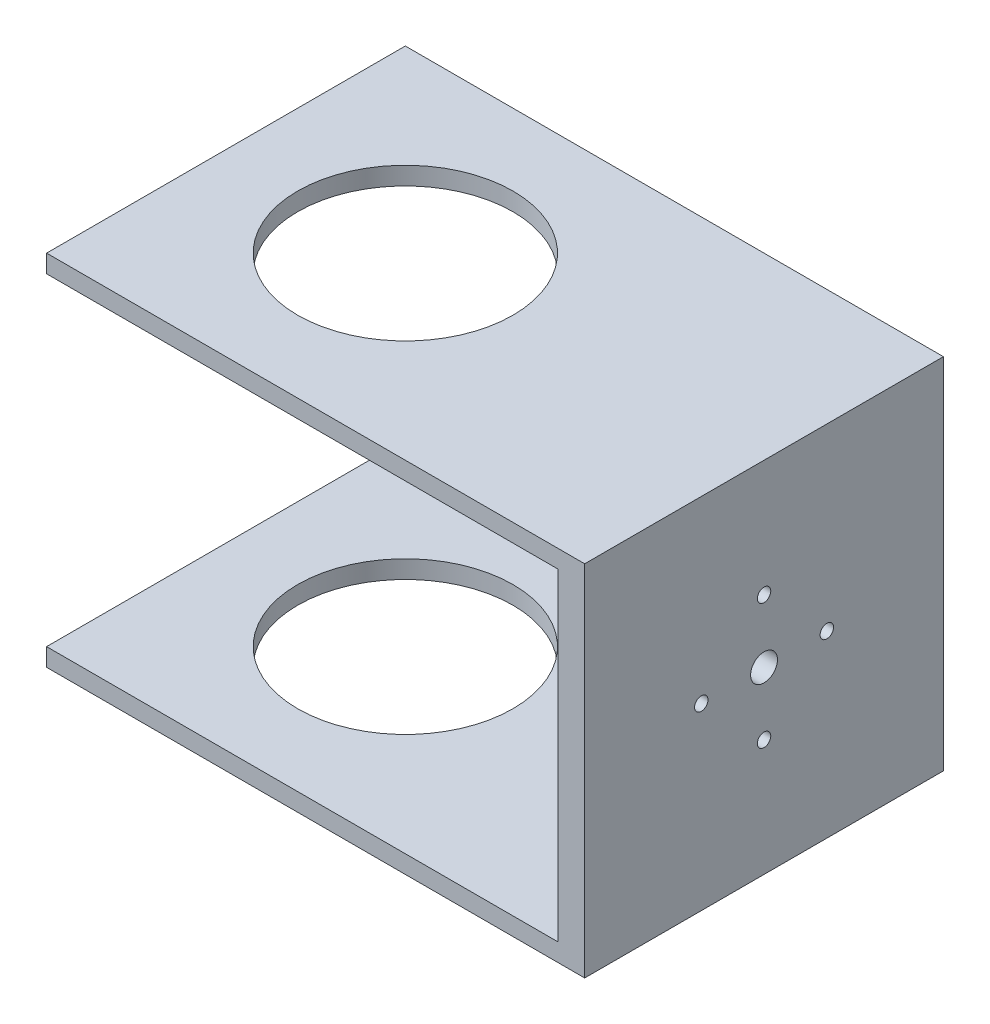
from build123d import *

# Parameters (mm, degrees)
SKETCH_1_W          = 60
SKETCH_1_H          = 40
EXTRUDE_1_DEPTH     = 40
SKETCH_2_W          = 40
SKETCH_2_H          = 36
CUT_EXTRUDE_1_DEPTH = 57
CUT_EXTRUDE_2_REACH = 84.462
SKETCH_3_R          = 1.5
SKETCH_4_R          = 0.75
CUT_EXTRUDE_3_DEPTH = 38
SKETCH_5_R          = 12
CUT_EXTRUDE_4_DEPTH = 83.462112512


with BuildPart() as part:
    # 草图1 → 凸台-拉伸1 (new body)
    with BuildSketch(Plane.XY):
        with Locations((30, 20)):
            Rectangle(SKETCH_1_W, SKETCH_1_H)
    extrude(amount=EXTRUDE_1_DEPTH)

    # 草图2 → 切除-拉伸1 (cut)
    with BuildSketch(Plane.ZY):
        with Locations((20, 20)):
            Rectangle(SKETCH_2_W, SKETCH_2_H)
    extrude(amount=-CUT_EXTRUDE_1_DEPTH, mode=Mode.SUBTRACT)

    # 草图3 → 切除-拉伸2 (cut, up to next)
    with BuildSketch(Plane(origin=(60, 0, 0), x_dir=(0, 0, -1), z_dir=(1, 0, 0)), mode=Mode.PRIVATE) as cut_extrude_2_sk1:
        with Locations((-20, 20)):
            Circle(SKETCH_3_R)
    cut_extrude_2_tool1 = extrude(cut_extrude_2_sk1.sketch, amount=-CUT_EXTRUDE_2_REACH, mode=Mode.PRIVATE) & part.part
    add(cut_extrude_2_tool1.solids().sort_by_distance((60, 20, 20))[0], mode=Mode.SUBTRACT)

    # 草图4 → 切除-拉伸3 (cut)
    with BuildSketch(Plane(origin=(60, 0, 0), x_dir=(0, 0, -1), z_dir=(1, 0, 0))):
        with Locations((-20, 27)):
            Circle(SKETCH_4_R)
        with Locations((-13, 20)):
            Circle(SKETCH_4_R)
        with Locations((-20, 13)):
            Circle(SKETCH_4_R)
        with Locations((-27, 20)):
            Circle(SKETCH_4_R)
    extrude(amount=-CUT_EXTRUDE_3_DEPTH, mode=Mode.SUBTRACT)

    # 草图5 → 切除-拉伸4 (cut, through all)
    with BuildSketch(Plane(origin=(0, 40, 0), x_dir=(1, 0, 0), z_dir=(0, 1, 0))):
        with Locations(Location((20, -20, 0), (0, 0, 270))):
            Circle(SKETCH_5_R)
    extrude(amount=-CUT_EXTRUDE_4_DEPTH, mode=Mode.SUBTRACT)


solid = part.part
